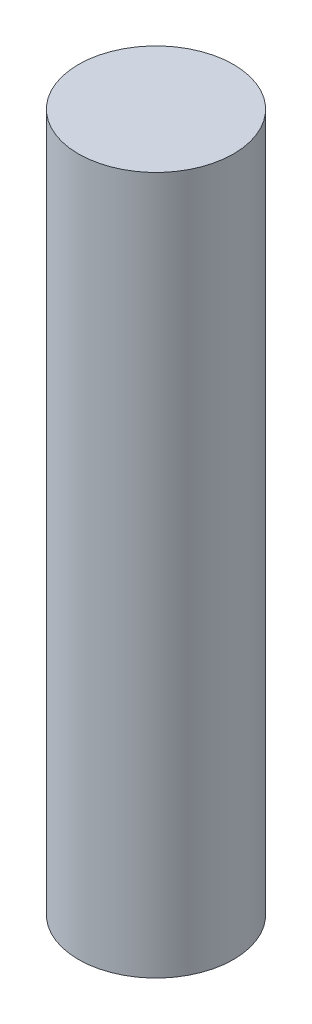
from build123d import *

# Parameters (mm, degrees)
SKETCH_2_R      = 2
EXTRUDE_1_DEPTH = 18


with BuildPart() as part:
    # Эскиз2 → Бобышка-Вытянуть1 (new body)
    with BuildSketch(Plane(origin=(0, 0, 0), x_dir=(1, 0, 0), z_dir=(0, 1, 0))):
        with Locations(Location((0, 0, 0), (0, 0, 270))):
            Circle(SKETCH_2_R)
    extrude(amount=EXTRUDE_1_DEPTH)


solid = part.part
